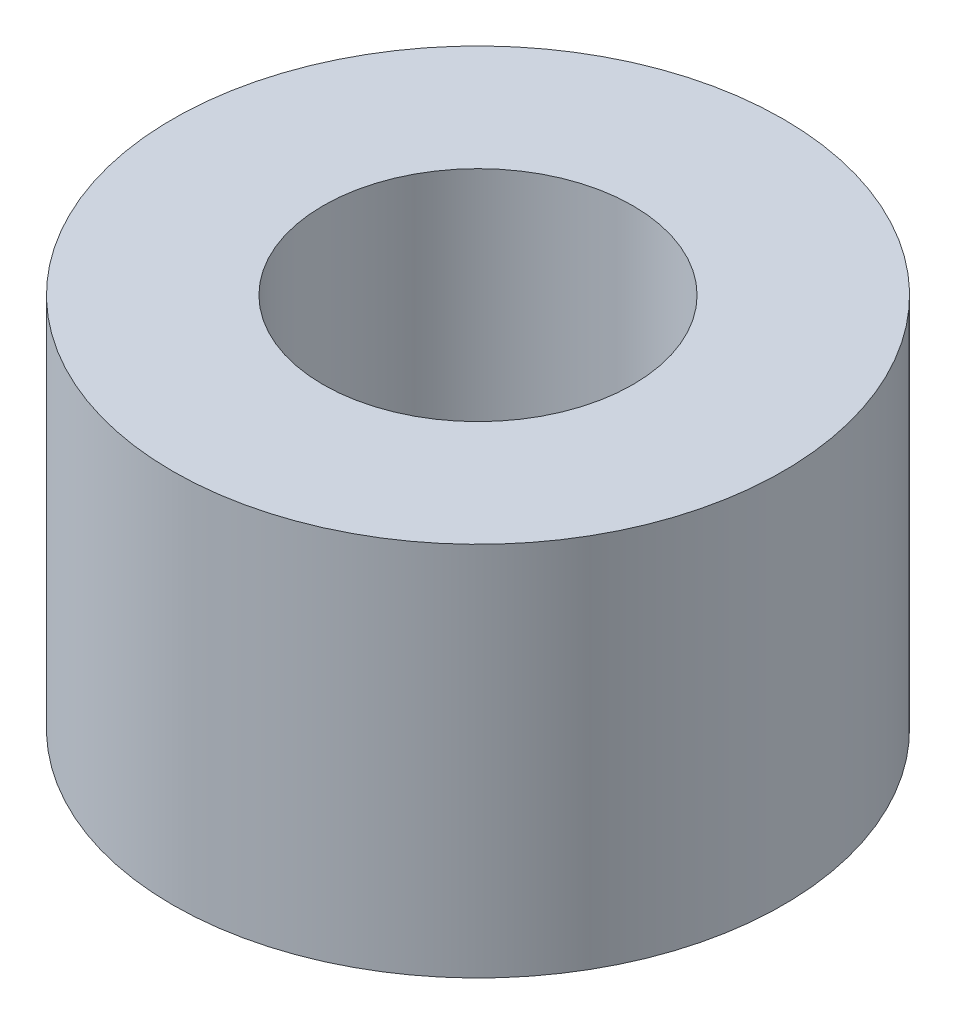
from build123d import *

# Parameters (mm, degrees)
SKETCH1_R           = 3.25
SKETCH1_R_2         = 1.65
BOSS_EXTRUDE1_DEPTH = 4


with BuildPart() as part:
    # Sketch1 → Boss-Extrude1 (new body)
    with BuildSketch(Plane(origin=(0, 0, 0), x_dir=(1, 0, 0), z_dir=(0, 1, 0))):
        with Locations(Location((0, 0, 0), (0, 0, 270))):
            Circle(SKETCH1_R)
        with Locations(Location((0, 0, 0), (0, 0, 270))):
            Circle(SKETCH1_R_2, mode=Mode.SUBTRACT)
    extrude(amount=BOSS_EXTRUDE1_DEPTH)


solid = part.part
